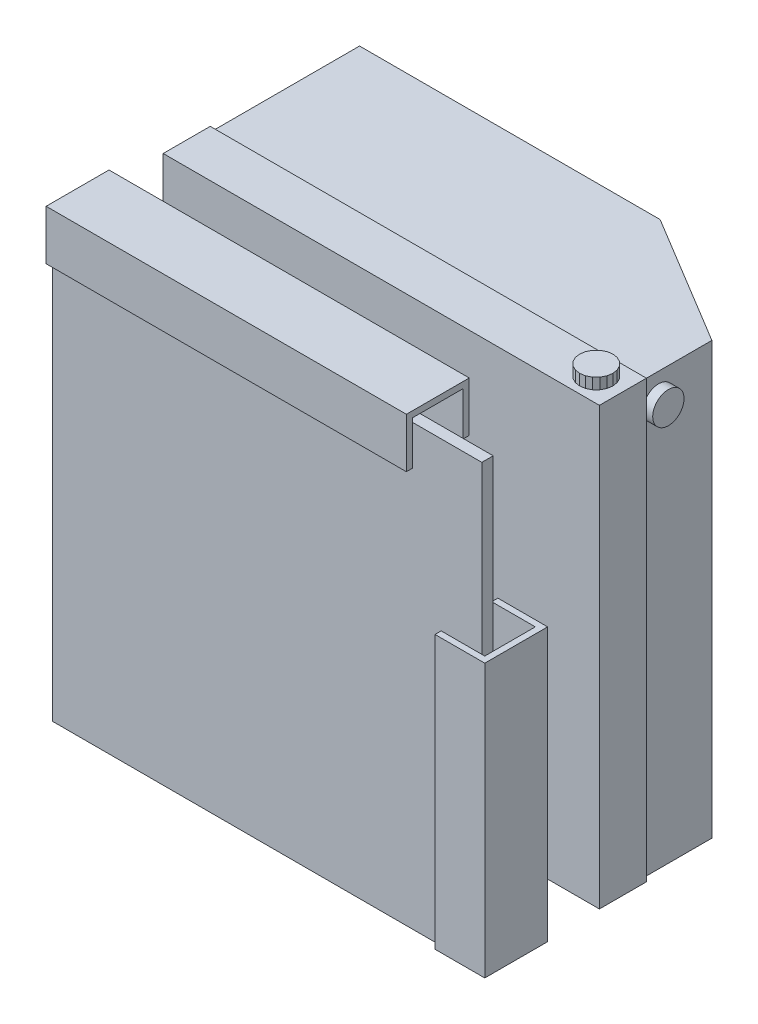
from build123d import *

# Parameters (mm, degrees)
HOUSING_DEPTH                      = 55
DIFFUSER_SKETCH_W                  = 109.6
DIFFUSER_SKETCH_H                  = 112
DIFFUSER_DEPTH                     = 1.45
SIDE_CHANNEL_DEPTH                 = 34.785
END_CHANNEL_DEPTH                  = 45.96
SIDE_SCREW_HEAD_SKETCH_R           = 4
SIDE_SCREW_HEAD_DEPTH              = 1.75
LENS_FRAME_LAP_SKETCH_W            = 111.3
LENS_FRAME_LAP_SKETCH_H            = 12
LENS_FRAME_LAP_DEPTH               = 55.65
CORNER_SCREW_HEAD_ON_THE_END_DEPTH = 2.55


with BuildPart() as part:
    # housing sketch → housing (new, symmetric)
    with BuildSketch(Plane(origin=(0, -55, 0), x_dir=(1, 0, 0), z_dir=(0, 1, 0))):
        Polygon((0, 0), (0, 30), (-33.304654329, 50.1), (-110, 50.1), (-110, 0), align=None)
    extrude(amount=HOUSING_DEPTH, both=True)

    # side screw head sketch → side screw head (add, symmetric)
    with BuildSketch(Plane(origin=(0.75, 0, 0), x_dir=(0, 0, -1), z_dir=(1, 0, 0))):
        with Locations(Location((16.4, -6.8, 0), (0, 0, 180))):
            Circle(SIDE_SCREW_HEAD_SKETCH_R)
    extrude(amount=SIDE_SCREW_HEAD_DEPTH, both=True)

    # lens frame lap sketch → lens frame lap (add, symmetric)
    with BuildSketch(Plane(origin=(0, -54.35, 0), x_dir=(1, 0, 0), z_dir=(0, 1, 0))):
        with Locations((-54.35, 6)):
            Rectangle(LENS_FRAME_LAP_SKETCH_W, LENS_FRAME_LAP_SKETCH_H)
    extrude(amount=LENS_FRAME_LAP_DEPTH, both=True)

    # corner screw head on the end sketch → corner screw head on the end (add, symmetric)
    with BuildSketch(Plane(origin=(0, 1.55, 0), x_dir=(1, 0, 0), z_dir=(0, 1, 0))):
        Polygon((-1.25, 6), (-1.458009806, 4.686677774), (-2.061677774, 3.501912678), (-3.001912678, 2.561677774), (-4.186677774, 1.958009806), (-5.5, 1.75), (-6.813322226, 1.958009806), (-7.998087322, 2.561677774), (-8.938322226, 3.501912678), (-9.541990194, 4.686677774), (-9.75, 6), (-9.541990194, 7.313322226), (-8.938322226, 8.498087322), (-7.998087322, 9.438322226), (-6.813322226, 10.041990194), (-5.5, 10.25), (-4.186677774, 10.041990194), (-3.001912678, 9.438322226), (-2.061677774, 8.498087322), (-1.458009806, 7.313322226), align=None)
    extrude(amount=CORNER_SCREW_HEAD_ON_THE_END_DEPTH, both=True)

    # insert flange sketch → insert flange (revolve)
    with BuildSketch(Plane(origin=(0, -20.7, 0), x_dir=(1, 0, 0), z_dir=(0, 1, 0))):
        Polygon((-18.324853729, 39.891397061), (-17.291434706, 41.60371862), (-12.026045911, 38.425955124), (-13.059464934, 36.713633565), align=None)
    revolve(axis=Axis((-18.324853729, -20.7, -39.891397061), (0.5167095115681243, 0, -0.8561607796757748)))


with BuildPart() as body_2:
    # diffuser sketch → diffuser (new, symmetric)
    with BuildSketch(Plane.XY.offset(26.85)):
        with Locations((-55.2, -54)):
            Rectangle(DIFFUSER_SKETCH_W, DIFFUSER_SKETCH_H)
    extrude(amount=DIFFUSER_DEPTH, both=True)

    # side channel sketch → side channel (add, symmetric)
    with BuildSketch(Plane(origin=(0, -75.215, 0), x_dir=(1, 0, 0), z_dir=(0, 1, 0))):
        Polygon((-10.78, -13.83), (1.92, -13.83), (1.92, -29.87), (-10.78, -29.87), (-10.78, -28.3), (0.35, -28.3), (0.35, -15.4), (-10.78, -15.4), align=None)
    extrude(amount=SIDE_CHANNEL_DEPTH, both=True)

    # end channel sketch → end channel (add, symmetric)
    with BuildSketch(Plane(origin=(-64.04, 0, 0), x_dir=(0, 0, -1), z_dir=(1, 0, 0))):
        Polygon((-13.83, -8.13), (-13.83, 4.57), (-29.87, 4.57), (-29.87, -8.13), (-28.3, -8.13), (-28.3, 3), (-15.4, 3), (-15.4, -8.13), align=None)
    extrude(amount=END_CHANNEL_DEPTH, both=True)


solid = Compound([part.part, body_2.part])
